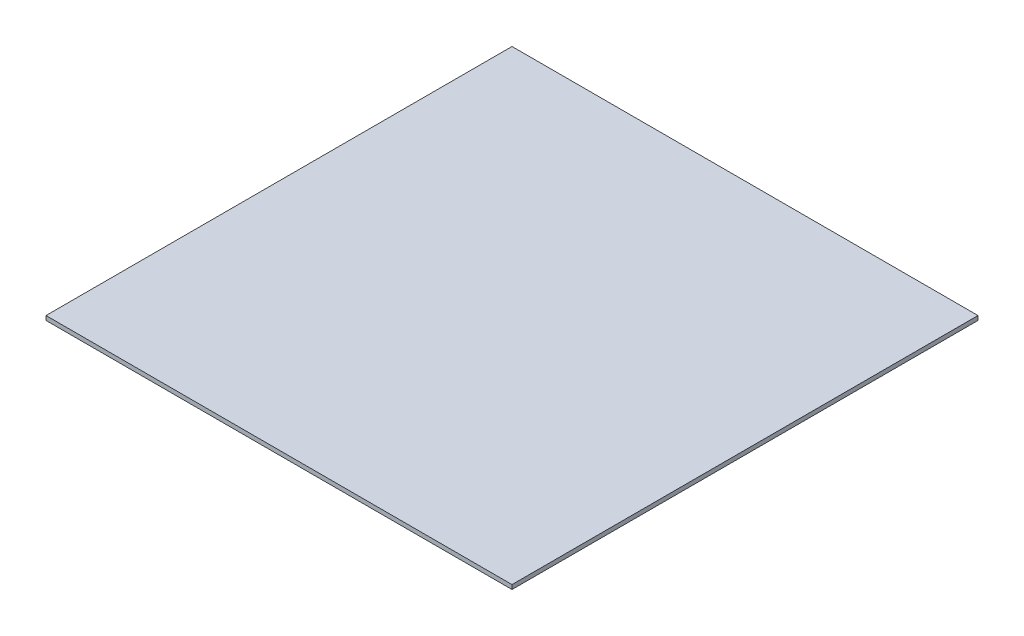
from build123d import *

# Parameters (mm, degrees)
SKETCH1_W           = 326
SKETCH1_H           = 326
BOSS_EXTRUDE1_DEPTH = 3


with BuildPart() as part:
    # Sketch1 → Boss-Extrude1 (new body)
    with BuildSketch(Plane(origin=(0, 0, 0), x_dir=(1, 0, 0), z_dir=(0, 1, 0))):
        Rectangle(SKETCH1_W, SKETCH1_H)
    extrude(amount=BOSS_EXTRUDE1_DEPTH)


solid = part.part
